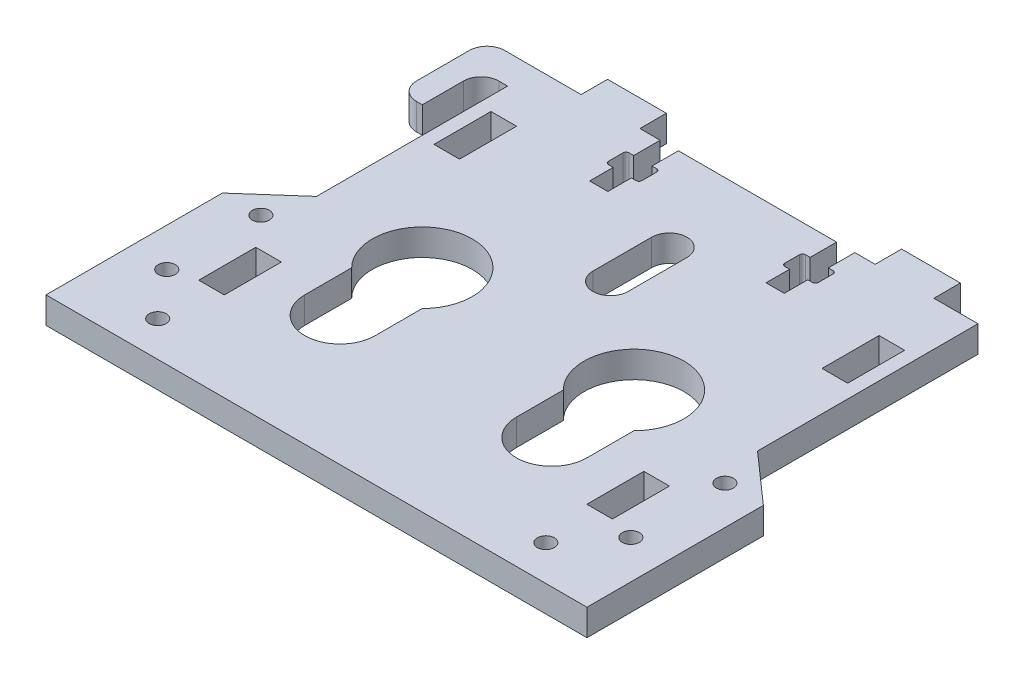
from build123d import *

# Parameters (mm, degrees)
SKETCH1_W            = 75
SKETCH1_H            = 75
MAINSHAPE_DEPTH      = 4.5
SKETCH5_W            = 4.35
SKETCH5_H            = 9.7
CUT_EXTRUDE3_DEPTH   = 54.223584998
CUT_EXTRUDE4_DEPTH   = 54.223584998
BOSS_EXTRUDE2_DEPTH  = 4.5
SKETCH8_R            = 1.45
CUT_EXTRUDE6_DEPTH   = 60.51890456
SKETCH11_W           = 10
SKETCH11_H           = 4.5
REARTABS_DEPTH       = 4.5
FRONTSCREWSLOT_DEPTH = 63.451981554
SKETCH14_R           = 1.45
BRACESCREWS_DEPTH    = 63.451981554
WIRINGSLOT_DEPTH     = 63.451981554
BOSS_EXTRUDE4_DEPTH  = 4.5


with BuildPart() as part:
    # Sketch1 → MainShape (new body)
    with BuildSketch(Plane(origin=(0, 0, 0), x_dir=(1, 0, 0), z_dir=(0, 1, 0))):
        Rectangle(SKETCH1_W, SKETCH1_H)
    extrude(amount=MAINSHAPE_DEPTH)

    # Sketch5 → Cut-Extrude3 (cut, through all)
    with BuildSketch(Plane(origin=(0, 4.5, 0), x_dir=(1, 0, 0), z_dir=(0, 1, 0))):
        with Locations((33, 22.5)):
            Rectangle(SKETCH5_W, SKETCH5_H)
        with Locations((-33, 22.5)):
            Rectangle(SKETCH5_W, SKETCH5_H)
        with Locations((-33, -17.5)):
            Rectangle(SKETCH5_W, SKETCH5_H)
        with Locations((33, -17.5)):
            Rectangle(SKETCH5_W, SKETCH5_H)
    extrude(amount=-CUT_EXTRUDE3_DEPTH, mode=Mode.SUBTRACT)

    # Sketch6 → Cut-Extrude4 (cut, through all)
    with BuildSketch(Plane(origin=(0, 4.5, 0), x_dir=(1, 0, 0), z_dir=(0, 1, 0))):
        with BuildLine():
            Line((-24, -15.5), (-24, -7.520797289))
            ThreePointArc((-24, -7.520797289), (-18, 7), (-12, -7.520797289))
            Line((-12, -7.520797289), (-12, -15.5))
            ThreePointArc((-12, -15.5), (-18, -21.5), (-24, -15.5))
        make_face()
    cut_extrude4 = extrude(amount=-CUT_EXTRUDE4_DEPTH, mode=Mode.SUBTRACT)

    # Sketch13 → Boss-Extrude2 (add, through all)
    with BuildSketch(Plane(origin=(0, 4.5, 0), x_dir=(1, 0, 0), z_dir=(0, 1, 0))):
        Polygon((-37.5, -37.5), (-37.5, 0), (-46, -7.5), (-46, -37.5), align=None)
        Polygon((37.5, 0), (37.5, -37.5), (46, -37.5), (46, -7.5), align=None)
    extrude(amount=-BOSS_EXTRUDE2_DEPTH)

    # Sketch8 → Cut-Extrude6 (cut, through all)
    with BuildSketch(Plane(origin=(0, 4.5, 0), x_dir=(1, 0, 0), z_dir=(0, 1, 0))):
        with Locations(Location((-39.46, -7.5, 0), (0, 0, 270))):
            Circle(SKETCH8_R)
        with Locations(Location((-39.46, -23.5, 0), (0, 0, 270))):
            Circle(SKETCH8_R)
    cut_extrude6 = extrude(amount=-CUT_EXTRUDE6_DEPTH, mode=Mode.SUBTRACT)

    # Mirror1: Cut-Extrude4, Cut-Extrude6 across plane
    add(cut_extrude4.mirror(Plane(origin=(0, 0, 0), x_dir=(0, 0, 1), z_dir=(1, 0, 0))), mode=Mode.SUBTRACT)
    add(cut_extrude6.mirror(Plane(origin=(0, 0, 0), x_dir=(0, 0, 1), z_dir=(1, 0, 0))), mode=Mode.SUBTRACT)

    # Sketch11 → RearTabs (add, through all)
    with BuildSketch(Plane(origin=(0, 4.5, 0), x_dir=(1, 0, 0), z_dir=(0, 1, 0))):
        with Locations((-25, 39.75)):
            Rectangle(SKETCH11_W, SKETCH11_H)
        with Locations((25, 39.75)):
            Rectangle(SKETCH11_W, SKETCH11_H)
    extrude(amount=-REARTABS_DEPTH)

    # Sketch12 → FrontScrewSlot (cut, through all)
    with BuildSketch(Plane(origin=(0, 4.5, 0), x_dir=(1, 0, 0), z_dir=(0, 1, 0))):
        with BuildLine():
            Line((-13.45, 37.5), (-16.55, 37.5))
            Line((-16.55, 37.5), (-16.55, 33))
            Line((-16.55, 33), (-17.35, 33))
            ThreePointArc((-17.35, 33), (-17.703553391, 32.853553391), (-17.85, 32.5))
            Line((-17.85, 32.5), (-17.85, 30))
            ThreePointArc((-17.85, 30), (-17.703553391, 29.646446609), (-17.35, 29.5))
            Line((-17.35, 29.5), (-16.55, 29.5))
            Line((-16.55, 29.5), (-16.55, 25.5))
            Line((-16.55, 25.5), (-13.45, 25.5))
            Line((-13.45, 25.5), (-13.45, 29.5))
            Line((-13.45, 29.5), (-12.65, 29.5))
            ThreePointArc((-12.65, 29.5), (-12.296446609, 29.646446609), (-12.15, 30))
            Line((-12.15, 30), (-12.15, 32.5))
            ThreePointArc((-12.15, 32.5), (-12.296446609, 32.853553391), (-12.65, 33))
            Line((-12.65, 33), (-13.45, 33))
            Line((-13.45, 33), (-13.45, 37.5))
        make_face()
        with BuildLine():
            Line((13.45, 37.5), (13.45, 33))
            Line((13.45, 33), (12.65, 33))
            ThreePointArc((12.65, 33), (12.296446609, 32.853553391), (12.15, 32.5))
            Line((12.15, 32.5), (12.15, 30))
            ThreePointArc((12.15, 30), (12.296446609, 29.646446609), (12.65, 29.5))
            Line((12.65, 29.5), (13.45, 29.5))
            Line((13.45, 29.5), (13.45, 25.5))
            Line((13.45, 25.5), (16.55, 25.5))
            Line((16.55, 25.5), (16.55, 29.5))
            Line((16.55, 29.5), (17.35, 29.5))
            ThreePointArc((17.35, 29.5), (17.703553391, 29.646446609), (17.85, 30))
            Line((17.85, 30), (17.85, 32.5))
            ThreePointArc((17.85, 32.5), (17.703553391, 32.853553391), (17.35, 33))
            Line((17.35, 33), (16.55, 33))
            Line((16.55, 33), (16.55, 37.5))
            Line((16.55, 37.5), (13.45, 37.5))
        make_face()
    extrude(amount=-FRONTSCREWSLOT_DEPTH, mode=Mode.SUBTRACT)

    # Sketch14 → BraceScrews (cut, through all)
    with BuildSketch(Plane(origin=(0, 4.5, 0), x_dir=(1, 0, 0), z_dir=(0, 1, 0))):
        with Locations(Location((-33, -31.5, 0), (0, 0, 270))):
            Circle(SKETCH14_R)
        with Locations(Location((33, -31.5, 0), (0, 0, 270))):
            Circle(SKETCH14_R)
    extrude(amount=-BRACESCREWS_DEPTH, mode=Mode.SUBTRACT)

    # Sketch16 → WiringSlot (cut, through all)
    with BuildSketch(Plane(origin=(0, 4.5, 0), x_dir=(1, 0, 0), z_dir=(0, 1, 0))):
        with BuildLine():
            Line((3, 22.5), (3, 12.5))
            ThreePointArc((3, 12.5), (0, 9.5), (-3, 12.5))
            Line((-3, 12.5), (-3, 22.5))
            ThreePointArc((-3, 22.5), (0, 25.5), (3, 22.5))
        make_face()
    extrude(amount=-WIRINGSLOT_DEPTH, mode=Mode.SUBTRACT)

    # Sketch21 → Boss-Extrude4 (add, through all)
    with BuildSketch(Plane(origin=(0, 4.5, 0), x_dir=(1, 0, 0), z_dir=(0, 1, 0))):
        with BuildLine():
            Line((-37, 37.5), (-43, 37.5))
            ThreePointArc((-43, 37.5), (-45.121320344, 36.621320344), (-46, 34.5))
            Line((-46, 34.5), (-46, 25.5))
            ThreePointArc((-46, 25.5), (-45.121320344, 23.378679656), (-43, 22.5))
            Line((-43, 22.5), (-42, 22.5))
            Line((-42, 22.5), (-42, 29.5))
            ThreePointArc((-42, 29.5), (-41.121320344, 31.621320344), (-39, 32.5))
            Line((-39, 32.5), (-37, 32.5))
            Line((-37, 32.5), (-37, 37.5))
        make_face()
    extrude(amount=-BOSS_EXTRUDE4_DEPTH)


solid = part.part
